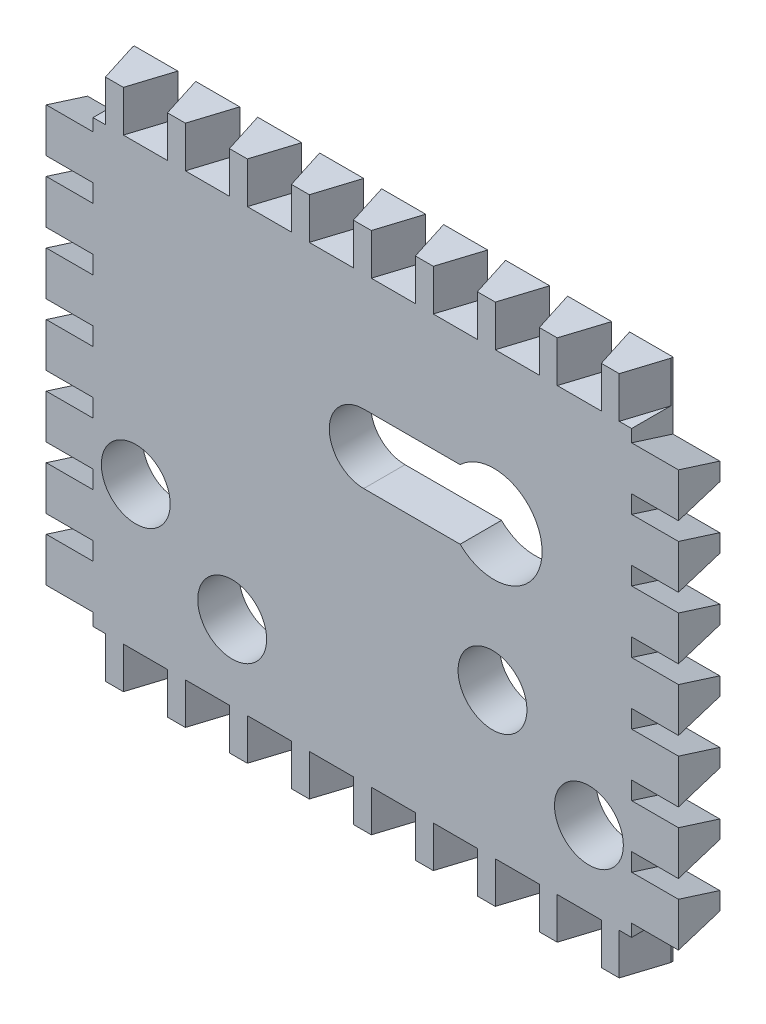
from build123d import *

# Parameters (mm, degrees)
SKETCH_1_W          = 45.9
SKETCH_1_H          = 38
EXTRUDE_1_DEPTH     = 3
CUT_EXTRUDE_3_DEPTH = 3.4
CUT_EXTRUDE_4_DEPTH = 3.4
CUT_EXTRUDE_5_DEPTH = 3
CUT_EXTRUDE_6_DEPTH = 3
SKETCH_9_R          = 2.5
CUT_EXTRUDE_7_DEPTH = 60.664143336


with BuildPart() as part:
    # 草图1 → 凸台-拉伸1 (new body)
    with BuildSketch(Plane.XY):
        with Locations((22.95, -19)):
            Rectangle(SKETCH_1_W, SKETCH_1_H)
    extrude(amount=EXTRUDE_1_DEPTH)

    # 草图3 → 切除-拉伸3 (cut)
    with BuildSketch(Plane.ZY):
        Polygon((3, -8.4), (3, -7.1), (0, -6.15), (0, -9.35), align=None)
        Polygon((0, -4.85), (3, -3.9), (3, 0), (0, 0), align=None)
        Polygon((3, -12.9), (3, -11.6), (0, -10.65), (0, -13.85), align=None)
        Polygon((3, -17.4), (3, -16.1), (0, -15.15), (0, -18.35), align=None)
        Polygon((3, -21.9), (3, -20.6), (0, -19.65), (0, -22.85), align=None)
        Polygon((3, -26.4), (3, -25.1), (0, -24.15), (0, -27.35), align=None)
        Polygon((3, -30.9), (3, -29.6), (0, -28.65), (0, -31.85), align=None)
        Polygon((3, -34.1), (0, -33.15), (0, -38), (3, -38), align=None)
    extrude(amount=-CUT_EXTRUDE_3_DEPTH, mode=Mode.SUBTRACT)

    # 草图5 → 切除-拉伸4 (cut)
    with BuildSketch(Plane(origin=(45.9, 0, 0), x_dir=(0, 0, -1), z_dir=(1, 0, 0))):
        Polygon((0, 0), (-3.00280668, 0), (-3.00280668, -3.9), (0, -4.85), align=None)
        Polygon((0, -6.15), (-3, -7.1), (-3, -8.4), (0, -9.35), align=None)
        Polygon((0, -33.15), (-3, -34.1), (-3, -38), (0, -38), align=None)
        Polygon((-3, -12.9), (0, -13.85), (0, -10.65), (-3, -11.6), align=None)
        Polygon((-3, -17.4), (0, -18.35), (0, -15.15), (-3, -16.1), align=None)
        Polygon((-3, -21.9), (0, -22.85), (0, -19.65), (-3, -20.6), align=None)
        Polygon((-3, -26.4), (0, -27.35), (0, -24.15), (-3, -25.1), align=None)
        Polygon((-3, -30.9), (0, -31.85), (0, -28.65), (-3, -29.6), align=None)
    extrude(amount=-CUT_EXTRUDE_4_DEPTH, mode=Mode.SUBTRACT)

    # 草图7 → 切除-拉伸5 (cut)
    with BuildSketch(Plane.XZ.offset(38)):
        Polygon((5.6, 3), (8.8, 3), (7.85, 0), (6.55, 0), align=None)
        Polygon((4.3, 3), (3.35, 0), (0, 0), (0, 3), align=None)
        Polygon((11.05, 0), (10.1, 3), (13.3, 3), (12.35, 0), align=None)
        Polygon((15.55, 0), (14.6, 3), (17.8, 3), (16.85, 0), align=None)
        Polygon((20.05, 0), (19.1, 3), (22.3, 3), (21.35, 0), align=None)
        Polygon((24.55, 0), (23.6, 3), (26.8, 3), (25.85, 0), align=None)
        Polygon((29.05, 0), (28.1, 3), (31.3, 3), (30.35, 0), align=None)
        Polygon((33.55, 0), (32.6, 3), (35.8, 3), (34.85, 0), align=None)
        Polygon((38.05, 0), (37.1, 3), (40.3, 3), (39.35, 0), align=None)
        Polygon((45.9, 0), (45.9, 3), (41.6, 3), (42.55, 0), align=None)
    extrude(amount=-CUT_EXTRUDE_5_DEPTH, mode=Mode.SUBTRACT)

    # 草图8 → 切除-拉伸6 (cut)
    with BuildSketch(Plane(origin=(0, 0, 0), x_dir=(1, 0, 0), z_dir=(0, 1, 0))):
        Polygon((6.55, 0), (5.6, -3), (8.8, -3), (7.85, 0), align=None)
        Polygon((3.35, 0), (4.3, -3), (0, -3), (0, 0), align=None)
        Polygon((12.35, 0), (11.05, 0), (10.1, -3), (13.3, -3), align=None)
        Polygon((16.85, 0), (15.55, 0), (14.6, -3), (17.8, -3), align=None)
        Polygon((21.35, 0), (20.05, 0), (19.1, -3), (22.3, -3), align=None)
        Polygon((25.85, 0), (24.55, 0), (23.6, -3), (26.8, -3), align=None)
        Polygon((30.35, 0), (29.05, 0), (28.1, -3), (31.3, -3), align=None)
        Polygon((34.85, 0), (33.55, 0), (32.6, -3), (35.8, -3), align=None)
        Polygon((39.35, 0), (38.05, 0), (37.1, -3), (40.3, -3), align=None)
        Polygon((45.9, -3), (45.9, 0), (42.55, 0), (41.6, -3), align=None)
    extrude(amount=-CUT_EXTRUDE_6_DEPTH, mode=Mode.SUBTRACT)

    # 草图9 → 切除-拉伸7 (cut, through all)
    with BuildSketch(Plane.XY.offset(3)):
        with Locations((32.4, -24.5)):
            Circle(SKETCH_9_R)
        with Locations((39.4, -29.5)):
            Circle(SKETCH_9_R)
        with Locations((6.5, -24.5)):
            Circle(SKETCH_9_R)
        with Locations((13.5, -29.5)):
            Circle(SKETCH_9_R)
        with BuildLine():
            Line((30.050510257, -16.5), (23.050510257, -16.5))
            ThreePointArc((23.050510257, -16.5), (20.550510257, -14), (23.050510257, -11.5))
            Line((23.050510257, -11.5), (30.050510257, -11.5))
            ThreePointArc((30.050510257, -11.5), (36, -14), (30.050510257, -16.5))
        make_face()
    extrude(amount=-CUT_EXTRUDE_7_DEPTH, mode=Mode.SUBTRACT)


solid = part.part
